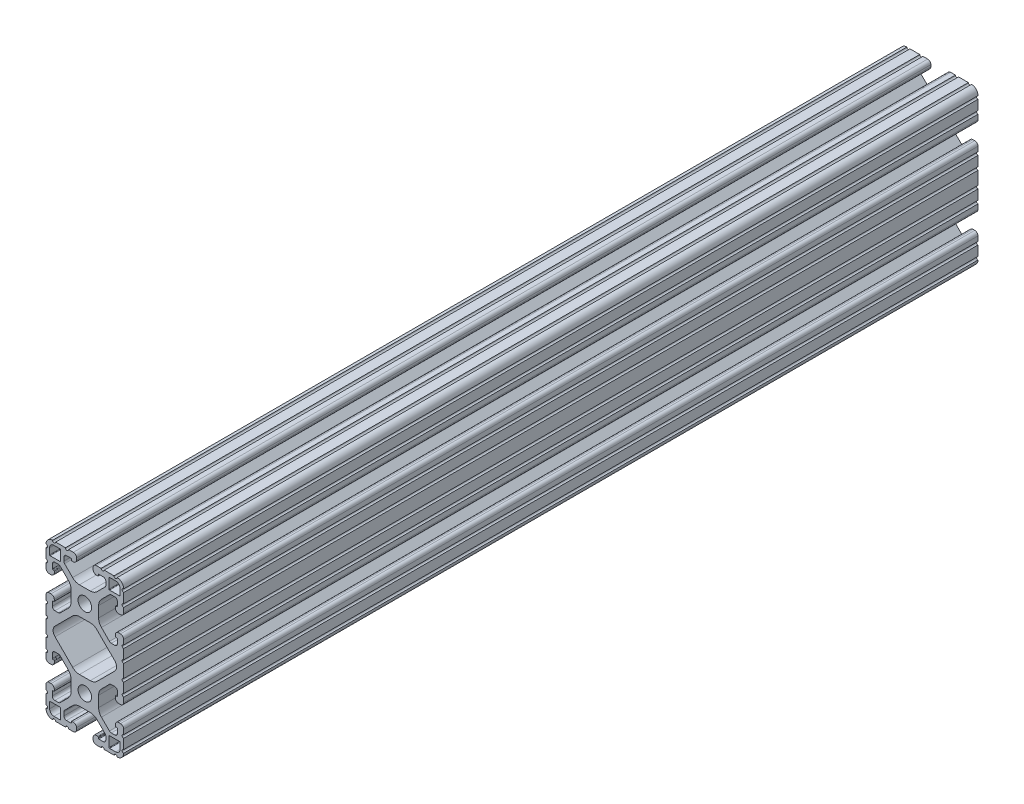
from build123d import *

# Parameters (mm, degrees)
SKETCH1_R           = 3.3274
BOSS_EXTRUDE1_DEPTH = 419.1


with BuildPart() as part:
    # Sketch1 → Boss-Extrude1 (new body)
    with BuildSketch(Plane(origin=(0, 0, -914.4), x_dir=(-1, 0, 0), z_dir=(0, 0, -1))):
        with BuildLine():
            Line((19.05, -14.3256), (19.05, -9.4996))
            ThreePointArc((19.05, -9.4996), (18.288, -8.7376), (19.05, -7.9756))
            Line((19.05, -7.9756), (19.05, -5.6388))
            ThreePointArc((19.05, -5.6388), (18.588751759, -4.525248241), (17.4752, -4.064))
            Line((17.4752, -4.064), (16.5608, -4.064))
            ThreePointArc((16.5608, -4.064), (15.447248241, -4.525248241), (14.986, -5.6388))
            Line((14.986, -5.6388), (14.986, -6.35))
            ThreePointArc((14.986, -6.35), (15.060394878, -6.529605122), (15.24, -6.604))
            Line((15.24, -6.604), (15.7099, -6.604))
            ThreePointArc((15.7099, -6.604), (15.889505122, -6.678394878), (15.9639, -6.858))
            Line((15.9639, -6.858), (15.9639, -9.017))
            ThreePointArc((15.9639, -9.017), (15.591925612, -9.915025612), (14.6939, -10.287))
            Line((14.6939, -10.287), (12.968312693, -10.287))
            ThreePointArc((12.968312693, -10.287), (12.482304734, -10.190327006), (12.070287081, -9.915025612))
            Line((12.070287081, -9.915025612), (8.147584211, -5.992322742))
            ThreePointArc((8.147584211, -5.992322742), (7.117956996, -4.451376719), (6.7564, -2.633706952))
            Line((6.7564, -2.633706952), (6.7564, 2.633706952))
            ThreePointArc((6.7564, 2.633706952), (7.117956996, 4.451376719), (8.147584211, 5.992322742))
            Line((8.147584211, 5.992322742), (12.070287081, 9.915025612))
            ThreePointArc((12.070287081, 9.915025612), (12.482304734, 10.190327006), (12.968312693, 10.287))
            Line((12.968312693, 10.287), (14.6939, 10.287))
            ThreePointArc((14.6939, 10.287), (15.591925612, 9.915025612), (15.9639, 9.017))
            Line((15.9639, 9.017), (15.9639, 6.858))
            ThreePointArc((15.9639, 6.858), (15.889505122, 6.678394878), (15.7099, 6.604))
            Line((15.7099, 6.604), (15.24, 6.604))
            ThreePointArc((15.24, 6.604), (15.060394878, 6.529605122), (14.986, 6.35))
            Line((14.986, 6.35), (14.986, 5.6388))
            ThreePointArc((14.986, 5.6388), (15.447248241, 4.525248241), (16.5608, 4.064))
            Line((16.5608, 4.064), (17.4752, 4.064))
            ThreePointArc((17.4752, 4.064), (18.588751759, 4.525248241), (19.05, 5.6388))
            Line((19.05, 5.6388), (19.05, 7.9756))
            ThreePointArc((19.05, 7.9756), (18.288, 8.7376), (19.05, 9.4996))
            Line((19.05, 9.4996), (19.05, 14.3256))
            ThreePointArc((19.05, 14.3256), (18.288, 15.0876), (19.05, 15.8496))
            Line((19.05, 15.8496), (19.05, 22.2504))
            ThreePointArc((19.05, 22.2504), (18.288, 23.0124), (19.05, 23.7744))
            Line((19.05, 23.7744), (19.05, 28.6004))
            ThreePointArc((19.05, 28.6004), (18.288, 29.3624), (19.05, 30.1244))
            Line((19.05, 30.1244), (19.05, 32.4612))
            ThreePointArc((19.05, 32.4612), (18.588751759, 33.574751759), (17.4752, 34.036))
            Line((17.4752, 34.036), (16.5608, 34.036))
            ThreePointArc((16.5608, 34.036), (15.447248241, 33.574751759), (14.986, 32.4612))
            Line((14.986, 32.4612), (14.986, 31.75))
            ThreePointArc((14.986, 31.75), (15.060394878, 31.570394878), (15.24, 31.496))
            Line((15.24, 31.496), (15.7099, 31.496))
            ThreePointArc((15.7099, 31.496), (15.889505122, 31.421605122), (15.9639, 31.242))
            Line((15.9639, 31.242), (15.9639, 29.083))
            ThreePointArc((15.9639, 29.083), (15.591925612, 28.184974388), (14.6939, 27.813))
            Line((14.6939, 27.813), (12.968312693, 27.813))
            ThreePointArc((12.968312693, 27.813), (12.482304734, 27.909672994), (12.070287081, 28.184974388))
            Line((12.070287081, 28.184974388), (8.147584211, 32.107677258))
            ThreePointArc((8.147584211, 32.107677258), (7.117956996, 33.648623281), (6.7564, 35.466293048))
            Line((6.7564, 35.466293048), (6.7564, 40.733706952))
            ThreePointArc((6.7564, 40.733706952), (7.117956996, 42.551376719), (8.147584211, 44.092322742))
            Line((8.147584211, 44.092322742), (12.070287081, 48.015025612))
            ThreePointArc((12.070287081, 48.015025612), (12.482304734, 48.290327006), (12.968312693, 48.387))
            Line((12.968312693, 48.387), (14.6939, 48.387))
            ThreePointArc((14.6939, 48.387), (15.591925612, 48.015025612), (15.9639, 47.117))
            Line((15.9639, 47.117), (15.9639, 44.958))
            ThreePointArc((15.9639, 44.958), (15.889505122, 44.778394878), (15.7099, 44.704))
            Line((15.7099, 44.704), (15.24, 44.704))
            ThreePointArc((15.24, 44.704), (15.060394878, 44.629605122), (14.986, 44.45))
            Line((14.986, 44.45), (14.986, 43.7388))
            ThreePointArc((14.986, 43.7388), (15.447248241, 42.625248241), (16.5608, 42.164))
            Line((16.5608, 42.164), (17.4752, 42.164))
            ThreePointArc((17.4752, 42.164), (18.588751759, 42.625248241), (19.05, 43.7388))
            Line((19.05, 43.7388), (19.05, 46.0756))
            ThreePointArc((19.05, 46.0756), (18.288, 46.8376), (19.05, 47.5996))
            Line((19.05, 47.5996), (19.05, 52.425599983))
            ThreePointArc((19.05, 52.425599983), (18.287999983, 53.187599965), (19.04999993, 53.949600017))
            ThreePointArc((19.04999993, 53.949600017), (18.120166371, 56.220166482), (15.849599896, 57.150000017))
            ThreePointArc((15.849599896, 57.150000017), (15.087599913, 56.388000034), (14.32559993, 57.150000017))
            Line((14.32559993, 57.150000017), (9.499599913, 57.150000017))
            ThreePointArc((9.499599913, 57.150000017), (8.737599913, 56.388000017), (7.975599913, 57.150000017))
            Line((7.975599913, 57.150000017), (5.638799984, 57.150000017))
            ThreePointArc((5.638799984, 57.150000017), (4.525248225, 56.688751776), (4.063999984, 55.575200017))
            Line((4.063999984, 55.575200017), (4.063999984, 54.6608))
            ThreePointArc((4.063999984, 54.6608), (4.525248225, 53.547248241), (5.638799984, 53.086))
            Line((5.638799984, 53.086), (6.35, 53.086))
            ThreePointArc((6.35, 53.086), (6.529605122, 53.160394878), (6.604, 53.34))
            Line((6.604, 53.34), (6.604, 53.8099))
            ThreePointArc((6.604, 53.8099), (6.678394878, 53.989505122), (6.858, 54.0639))
            Line((6.858, 54.0639), (9.017, 54.0639))
            ThreePointArc((9.017, 54.0639), (9.915025612, 53.691925612), (10.287, 52.7939))
            Line((10.287, 52.7939), (10.287, 51.068312693))
            ThreePointArc((10.287, 51.068312693), (10.190327006, 50.582304734), (9.915025612, 50.170287081))
            Line((9.915025612, 50.170287081), (5.992322742, 46.247584211))
            ThreePointArc((5.992322742, 46.247584211), (4.451376719, 45.217956996), (2.633706952, 44.8564))
            Line((2.633706952, 44.8564), (-2.633706952, 44.8564))
            ThreePointArc((-2.633706952, 44.8564), (-4.451376719, 45.217956996), (-5.992322742, 46.247584211))
            Line((-5.992322742, 46.247584211), (-9.915025612, 50.170287081))
            ThreePointArc((-9.915025612, 50.170287081), (-10.190327006, 50.582304734), (-10.287, 51.068312693))
            Line((-10.287, 51.068312693), (-10.287, 52.7939))
            ThreePointArc((-10.287, 52.7939), (-9.915025612, 53.691925612), (-9.017, 54.0639))
            Line((-9.017, 54.0639), (-6.858, 54.0639))
            ThreePointArc((-6.858, 54.0639), (-6.678394878, 53.989505122), (-6.604, 53.8099))
            Line((-6.604, 53.8099), (-6.604, 53.34))
            ThreePointArc((-6.604, 53.34), (-6.529605122, 53.160394878), (-6.35, 53.086))
            Line((-6.35, 53.086), (-5.638800016, 53.086))
            ThreePointArc((-5.638800016, 53.086), (-4.525248257, 53.547248241), (-4.064000016, 54.6608))
            Line((-4.064000016, 54.6608), (-4.064000016, 55.575200017))
            ThreePointArc((-4.064000016, 55.575200017), (-4.525248257, 56.688751776), (-5.638800016, 57.150000017))
            Line((-5.638800016, 57.150000017), (-7.975600087, 57.150000017))
            ThreePointArc((-7.975600087, 57.150000017), (-8.737600087, 56.388000017), (-9.499600087, 57.150000017))
            Line((-9.499600087, 57.150000017), (-14.325600087, 57.150000017))
            ThreePointArc((-14.325600087, 57.150000017), (-15.087600087, 56.388000017), (-15.849600087, 57.150000017))
            ThreePointArc((-15.849600087, 57.150000017), (-18.120166552, 56.220166458), (-19.050000087, 53.949599983))
            ThreePointArc((-19.050000087, 53.949599983), (-18.288000017, 53.187600043), (-19.05, 52.425600017))
            Line((-19.05, 52.425600017), (-19.05, 47.5996))
            ThreePointArc((-19.05, 47.5996), (-18.288, 46.8376), (-19.05, 46.0756))
            Line((-19.05, 46.0756), (-19.05, 43.7388))
            ThreePointArc((-19.05, 43.7388), (-18.588751759, 42.625248241), (-17.4752, 42.164))
            Line((-17.4752, 42.164), (-16.5608, 42.164))
            ThreePointArc((-16.5608, 42.164), (-15.447248241, 42.625248241), (-14.986, 43.7388))
            Line((-14.986, 43.7388), (-14.986, 44.45))
            ThreePointArc((-14.986, 44.45), (-15.060394878, 44.629605122), (-15.24, 44.704))
            Line((-15.24, 44.704), (-15.7099, 44.704))
            ThreePointArc((-15.7099, 44.704), (-15.889505122, 44.778394878), (-15.9639, 44.958))
            Line((-15.9639, 44.958), (-15.9639, 47.117))
            ThreePointArc((-15.9639, 47.117), (-15.591925612, 48.015025612), (-14.6939, 48.387))
            Line((-14.6939, 48.387), (-12.968312693, 48.387))
            ThreePointArc((-12.968312693, 48.387), (-12.482304734, 48.290327006), (-12.070287081, 48.015025612))
            Line((-12.070287081, 48.015025612), (-8.147584211, 44.092322742))
            ThreePointArc((-8.147584211, 44.092322742), (-7.117956996, 42.551376719), (-6.7564, 40.733706952))
            Line((-6.7564, 40.733706952), (-6.7564, 35.466293048))
            ThreePointArc((-6.7564, 35.466293048), (-7.117956996, 33.648623281), (-8.147584211, 32.107677258))
            Line((-8.147584211, 32.107677258), (-12.070287081, 28.184974388))
            ThreePointArc((-12.070287081, 28.184974388), (-12.482304734, 27.909672994), (-12.968312693, 27.813))
            Line((-12.968312693, 27.813), (-14.6939, 27.813))
            ThreePointArc((-14.6939, 27.813), (-15.591925612, 28.184974388), (-15.9639, 29.083))
            Line((-15.9639, 29.083), (-15.9639, 31.242))
            ThreePointArc((-15.9639, 31.242), (-15.889505122, 31.421605122), (-15.7099, 31.496))
            Line((-15.7099, 31.496), (-15.24, 31.496))
            ThreePointArc((-15.24, 31.496), (-15.060394878, 31.570394878), (-14.986, 31.75))
            Line((-14.986, 31.75), (-14.986, 32.4612))
            ThreePointArc((-14.986, 32.4612), (-15.447248241, 33.574751759), (-16.5608, 34.036))
            Line((-16.5608, 34.036), (-17.4752, 34.036))
            ThreePointArc((-17.4752, 34.036), (-18.588751759, 33.574751759), (-19.05, 32.4612))
            Line((-19.05, 32.4612), (-19.05, 30.1244))
            ThreePointArc((-19.05, 30.1244), (-18.288, 29.3624), (-19.05, 28.6004))
            Line((-19.05, 28.6004), (-19.05, 23.7744))
            ThreePointArc((-19.05, 23.7744), (-18.288, 23.0124), (-19.05, 22.2504))
            Line((-19.05, 22.2504), (-19.05, 15.8496))
            ThreePointArc((-19.05, 15.8496), (-18.288, 15.0876), (-19.05, 14.3256))
            Line((-19.05, 14.3256), (-19.05, 9.4996))
            ThreePointArc((-19.05, 9.4996), (-18.288, 8.7376), (-19.05, 7.9756))
            Line((-19.05, 7.9756), (-19.05, 5.6388))
            ThreePointArc((-19.05, 5.6388), (-18.588751759, 4.525248241), (-17.4752, 4.064))
            Line((-17.4752, 4.064), (-16.5608, 4.064))
            ThreePointArc((-16.5608, 4.064), (-15.447248241, 4.525248241), (-14.986, 5.6388))
            Line((-14.986, 5.6388), (-14.986, 6.35))
            ThreePointArc((-14.986, 6.35), (-15.060394878, 6.529605122), (-15.24, 6.604))
            Line((-15.24, 6.604), (-15.7099, 6.604))
            ThreePointArc((-15.7099, 6.604), (-15.889505122, 6.678394878), (-15.9639, 6.858))
            Line((-15.9639, 6.858), (-15.9639, 9.017))
            ThreePointArc((-15.9639, 9.017), (-15.591925612, 9.915025612), (-14.6939, 10.287))
            Line((-14.6939, 10.287), (-12.968312693, 10.287))
            ThreePointArc((-12.968312693, 10.287), (-12.482304734, 10.190327006), (-12.070287081, 9.915025612))
            Line((-12.070287081, 9.915025612), (-8.147584211, 5.992322742))
            ThreePointArc((-8.147584211, 5.992322742), (-7.117956996, 4.451376719), (-6.7564, 2.633706952))
            Line((-6.7564, 2.633706952), (-6.7564, -2.633706952))
            ThreePointArc((-6.7564, -2.633706952), (-7.117956996, -4.451376719), (-8.147584211, -5.992322742))
            Line((-8.147584211, -5.992322742), (-12.070287081, -9.915025612))
            ThreePointArc((-12.070287081, -9.915025612), (-12.482304734, -10.190327006), (-12.968312693, -10.287))
            Line((-12.968312693, -10.287), (-14.6939, -10.287))
            ThreePointArc((-14.6939, -10.287), (-15.591925612, -9.915025612), (-15.9639, -9.017))
            Line((-15.9639, -9.017), (-15.9639, -6.858))
            ThreePointArc((-15.9639, -6.858), (-15.889505122, -6.678394878), (-15.7099, -6.604))
            Line((-15.7099, -6.604), (-15.24, -6.604))
            ThreePointArc((-15.24, -6.604), (-15.060394878, -6.529605122), (-14.986, -6.35))
            Line((-14.986, -6.35), (-14.986, -5.6388))
            ThreePointArc((-14.986, -5.6388), (-15.447248241, -4.525248241), (-16.5608, -4.064))
            Line((-16.5608, -4.064), (-17.4752, -4.064))
            ThreePointArc((-17.4752, -4.064), (-18.588751759, -4.525248241), (-19.05, -5.6388))
            Line((-19.05, -5.6388), (-19.05, -7.9756))
            ThreePointArc((-19.05, -7.9756), (-18.288, -8.7376), (-19.05, -9.4996))
            Line((-19.05, -9.4996), (-19.05, -14.3256))
            ThreePointArc((-19.05, -14.3256), (-18.288, -15.087600017), (-19.050000033, -15.8496))
            ThreePointArc((-19.050000033, -15.8496), (-18.120166474, -18.120166465), (-15.849599999, -19.05))
            ThreePointArc((-15.849599999, -19.05), (-15.087600016, -18.288000017), (-14.325600033, -19.05))
            Line((-14.325600033, -19.05), (-9.499600016, -19.05))
            ThreePointArc((-9.499600016, -19.05), (-8.737600016, -18.288), (-7.975600016, -19.05))
            Line((-7.975600016, -19.05), (-5.638800016, -19.05))
            ThreePointArc((-5.638800016, -19.05), (-4.525248257, -18.588751759), (-4.064000016, -17.4752))
            Line((-4.064000016, -17.4752), (-4.064000016, -16.5608))
            ThreePointArc((-4.064000016, -16.5608), (-4.525248257, -15.447248241), (-5.638800016, -14.986))
            Line((-5.638800016, -14.986), (-6.35, -14.986))
            ThreePointArc((-6.35, -14.986), (-6.529605122, -15.060394878), (-6.604, -15.24))
            Line((-6.604, -15.24), (-6.604, -15.7099))
            ThreePointArc((-6.604, -15.7099), (-6.678394878, -15.889505122), (-6.858, -15.9639))
            Line((-6.858, -15.9639), (-9.017, -15.9639))
            ThreePointArc((-9.017, -15.9639), (-9.915025612, -15.591925612), (-10.287, -14.6939))
            Line((-10.287, -14.6939), (-10.287, -12.968312693))
            ThreePointArc((-10.287, -12.968312693), (-10.190327006, -12.482304734), (-9.915025612, -12.070287081))
            Line((-9.915025612, -12.070287081), (-5.992322742, -8.147584211))
            ThreePointArc((-5.992322742, -8.147584211), (-4.451376719, -7.117956996), (-2.633706952, -6.7564))
            Line((-2.633706952, -6.7564), (2.633706952, -6.7564))
            ThreePointArc((2.633706952, -6.7564), (4.451376719, -7.117956996), (5.992322742, -8.147584211))
            Line((5.992322742, -8.147584211), (9.915025612, -12.070287081))
            ThreePointArc((9.915025612, -12.070287081), (10.190327006, -12.482304734), (10.287, -12.968312693))
            Line((10.287, -12.968312693), (10.287, -14.6939))
            ThreePointArc((10.287, -14.6939), (9.915025612, -15.591925612), (9.017, -15.9639))
            Line((9.017, -15.9639), (6.858, -15.9639))
            ThreePointArc((6.858, -15.9639), (6.678394878, -15.889505122), (6.604, -15.7099))
            Line((6.604, -15.7099), (6.604, -15.24))
            ThreePointArc((6.604, -15.24), (6.529605122, -15.060394878), (6.35, -14.986))
            Line((6.35, -14.986), (5.638799984, -14.986))
            ThreePointArc((5.638799984, -14.986), (4.525248225, -15.447248241), (4.063999984, -16.5608))
            Line((4.063999984, -16.5608), (4.063999984, -17.4752))
            ThreePointArc((4.063999984, -17.4752), (4.525248225, -18.588751759), (5.638799984, -19.05))
            Line((5.638799984, -19.05), (7.975599984, -19.05))
            ThreePointArc((7.975599984, -19.05), (8.737599984, -18.288), (9.499599984, -19.05))
            Line((9.499599984, -19.05), (14.325599984, -19.05))
            ThreePointArc((14.325599984, -19.05), (15.087599984, -18.288), (15.849599984, -19.05))
            ThreePointArc((15.849599984, -19.05), (18.120166437, -18.120166453), (19.049999984, -15.8496))
            ThreePointArc((19.049999984, -15.8496), (18.288, -15.087599992), (19.05, -14.3256))
        make_face()
        with Locations(Location((0, 0, 0), (0, 0, 180))):
            Circle(SKETCH1_R, mode=Mode.SUBTRACT)
        with Locations(Location((0, 38.1, 0), (0, 0, 180))):
            Circle(SKETCH1_R, mode=Mode.SUBTRACT)
        with BuildLine():
            Line((-11.8872, -12.1412), (-11.8872, -17.018))
            ThreePointArc((-11.8872, -17.018), (-11.961594878, -17.197605122), (-12.1412, -17.272))
            Line((-12.1412, -17.272), (-15.1384, -17.272))
            ThreePointArc((-15.1384, -17.272), (-16.647083028, -16.647083028), (-17.272, -15.1384))
            Line((-17.272, -15.1384), (-17.272, -12.1412))
            ThreePointArc((-17.272, -12.1412), (-17.197605122, -11.961594878), (-17.018, -11.8872))
            Line((-17.018, -11.8872), (-12.1412, -11.8872))
            ThreePointArc((-12.1412, -11.8872), (-11.961594878, -11.961594878), (-11.8872, -12.1412))
        make_face(mode=Mode.SUBTRACT)
        with BuildLine():
            Line((-15.1384, 55.372), (-12.1412, 55.372))
            ThreePointArc((-12.1412, 55.372), (-11.961594878, 55.297605122), (-11.8872, 55.118))
            Line((-11.8872, 55.118), (-11.8872, 50.2412))
            ThreePointArc((-11.8872, 50.2412), (-11.961594878, 50.061594878), (-12.1412, 49.9872))
            Line((-12.1412, 49.9872), (-17.018, 49.9872))
            ThreePointArc((-17.018, 49.9872), (-17.197605122, 50.061594878), (-17.272, 50.2412))
            Line((-17.272, 50.2412), (-17.272, 53.2384))
            ThreePointArc((-17.272, 53.2384), (-16.647083028, 54.747083028), (-15.1384, 55.372))
        make_face(mode=Mode.SUBTRACT)
        with BuildLine():
            Line((5.992322742, 29.952415789), (14.618886052, 21.325852479))
            ThreePointArc((14.618886052, 21.325852479), (15.561575015, 19.05), (14.618886052, 16.774147521))
            Line((14.618886052, 16.774147521), (5.992322742, 8.147584211))
            ThreePointArc((5.992322742, 8.147584211), (4.451376719, 7.117956996), (2.633706952, 6.7564))
            Line((2.633706952, 6.7564), (-2.633706952, 6.7564))
            ThreePointArc((-2.633706952, 6.7564), (-4.451376719, 7.117956996), (-5.992322742, 8.147584211))
            Line((-5.992322742, 8.147584211), (-14.618886052, 16.774147521))
            ThreePointArc((-14.618886052, 16.774147521), (-15.561575015, 19.05), (-14.618886052, 21.325852479))
            Line((-14.618886052, 21.325852479), (-5.992322742, 29.952415789))
            ThreePointArc((-5.992322742, 29.952415789), (-4.451376719, 30.982043004), (-2.633706952, 31.3436))
            Line((-2.633706952, 31.3436), (2.633706952, 31.3436))
            ThreePointArc((2.633706952, 31.3436), (4.451376719, 30.982043004), (5.992322742, 29.952415789))
        make_face(mode=Mode.SUBTRACT)
        with BuildLine():
            Line((17.272, -12.1412), (17.272, -15.1384))
            ThreePointArc((17.272, -15.1384), (16.647083028, -16.647083028), (15.1384, -17.272))
            Line((15.1384, -17.272), (12.1412, -17.272))
            ThreePointArc((12.1412, -17.272), (11.961594878, -17.197605122), (11.8872, -17.018))
            Line((11.8872, -17.018), (11.8872, -12.1412))
            ThreePointArc((11.8872, -12.1412), (11.961594878, -11.961594878), (12.1412, -11.8872))
            Line((12.1412, -11.8872), (17.018, -11.8872))
            ThreePointArc((17.018, -11.8872), (17.197605122, -11.961594878), (17.272, -12.1412))
        make_face(mode=Mode.SUBTRACT)
        with BuildLine():
            Line((12.1412, 55.372), (15.1384, 55.372))
            ThreePointArc((15.1384, 55.372), (16.647083028, 54.747083028), (17.272, 53.2384))
            Line((17.272, 53.2384), (17.272, 50.2412))
            ThreePointArc((17.272, 50.2412), (17.197605122, 50.061594878), (17.018, 49.9872))
            Line((17.018, 49.9872), (12.1412, 49.9872))
            ThreePointArc((12.1412, 49.9872), (11.961594878, 50.061594878), (11.8872, 50.2412))
            Line((11.8872, 50.2412), (11.8872, 55.118))
            ThreePointArc((11.8872, 55.118), (11.961594878, 55.297605122), (12.1412, 55.372))
        make_face(mode=Mode.SUBTRACT)
    extrude(amount=-BOSS_EXTRUDE1_DEPTH)


solid = part.part
